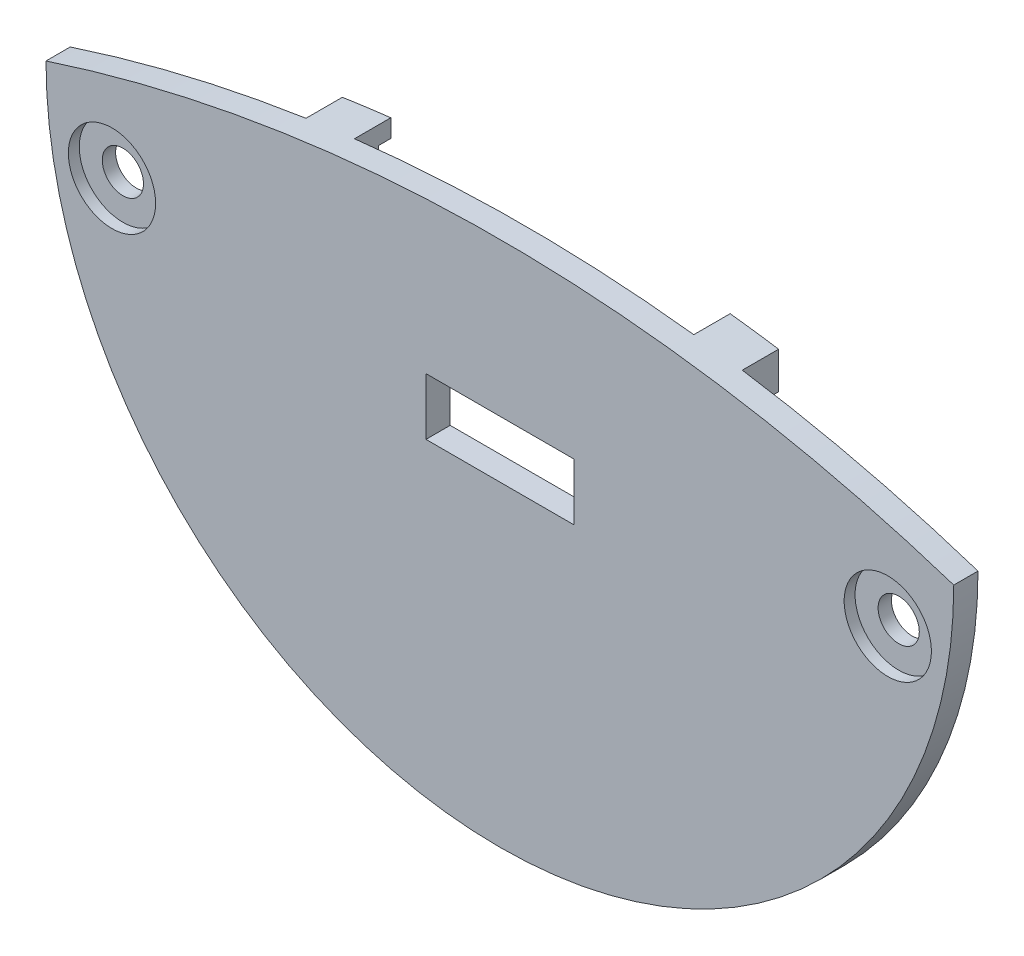
from build123d import *

# Parameters (mm, degrees)
SKETCH_2_R          = 1.7
SKETCH_2_W          = 12.2
SKETCH_2_H          = 4.7
EXTRUDE_1_DEPTH     = 2
SKETCH_3_R          = 3.6
CUT_EXTRUDE_1_DEPTH = 0.9
SKETCH_4_W          = 2
SKETCH_4_H          = 1.5
EXTRUDE_2_DEPTH     = 2
EXTRUDE_3_DEPTH     = 1


with BuildPart() as part:
    # 草图2 → 凸台-拉伸1 (new body)
    with BuildSketch(Plane.XY):
        with BuildLine():
            ThreePointArc((-37.449996405, 0.016409414), (0, -37.45), (37.449996405, 0.016409414))
            ThreePointArc((37.449996405, 0.016409414), (0, 6), (-37.449996405, 0.016409414))
        make_face()
        with Locations((-32.006251973, -5.643565774)):
            Circle(SKETCH_2_R, mode=Mode.SUBTRACT)
        with Locations((32.006251973, -5.643565774)):
            Circle(SKETCH_2_R, mode=Mode.SUBTRACT)
        with Locations((0, -9)):
            Rectangle(SKETCH_2_W, SKETCH_2_H, mode=Mode.SUBTRACT)
    extrude(amount=-EXTRUDE_1_DEPTH)

    # 草图3 → 切除-拉伸1 (cut)
    with BuildSketch(Plane.XY):
        with Locations((-32.006251973, -5.643565774)):
            Circle(SKETCH_3_R)
        with Locations((32.006251973, -5.643565774)):
            Circle(SKETCH_3_R)
    extrude(amount=-CUT_EXTRUDE_1_DEPTH, mode=Mode.SUBTRACT)

    # 草图4 → 凸台-拉伸2 (add)
    with BuildSketch(Plane(origin=(0, 0, -2), x_dir=(-1, 0, 0), z_dir=(0, 0, -1))):
        with Locations((-16, -32.4)):
            Rectangle(SKETCH_4_W, SKETCH_4_H)
        with Locations((16, -32.4)):
            Rectangle(SKETCH_4_W, SKETCH_4_H)
        with BuildLine():
            Line((-18, 1.6), (-18, 4.644461846))
            ThreePointArc((-18, 4.644461846), (-16.002255751, 4.929933515), (-14, 5.181822509))
            Line((-14, 5.181822509), (-14, 1.6))
            Line((-14, 1.6), (-18, 1.6))
        make_face()
        with BuildLine():
            Line((18, 4.644461846), (18, 1.6))
            Line((18, 1.6), (14, 1.6))
            Line((14, 1.6), (14, 5.181822509))
            ThreePointArc((14, 5.181822509), (16.002255751, 4.929933515), (18, 4.644461846))
        make_face()
    extrude(amount=EXTRUDE_2_DEPTH)

    # 草图5 → 凸台-拉伸3 (add)
    with BuildSketch(Plane(origin=(0, 0, -4), x_dir=(-1, 0, 0), z_dir=(0, 0, -1))):
        Polygon((-16.1, -32.5), (-15, -32.5), (-15, -33.15), (-17, -33.15), (-17, -31.65), (-16.1, -31.65), align=None)
        Polygon((16.1, -32.5), (16.1, -31.65), (17, -31.65), (17, -33.15), (15, -33.15), (15, -32.5), align=None)
        with BuildLine():
            Line((-18, 1.6), (-18, 4.644461846))
            ThreePointArc((-18, 4.644461846), (-16.002255751, 4.929933515), (-14, 5.181822509))
            Line((-14, 5.181822509), (-14, 3.7))
            Line((-14, 3.7), (-16.1, 3.7))
            Line((-16.1, 3.7), (-16.1, 1.6))
            Line((-16.1, 1.6), (-18, 1.6))
        make_face()
        with BuildLine():
            Line((14, 3.7), (14, 5.181822509))
            ThreePointArc((14, 5.181822509), (16.002255751, 4.929933515), (18, 4.644461846))
            Line((18, 4.644461846), (18, 1.6))
            Line((18, 1.6), (16.1, 1.6))
            Line((16.1, 1.6), (16.1, 3.7))
            Line((16.1, 3.7), (14, 3.7))
        make_face()
    extrude(amount=EXTRUDE_3_DEPTH)


solid = part.part
